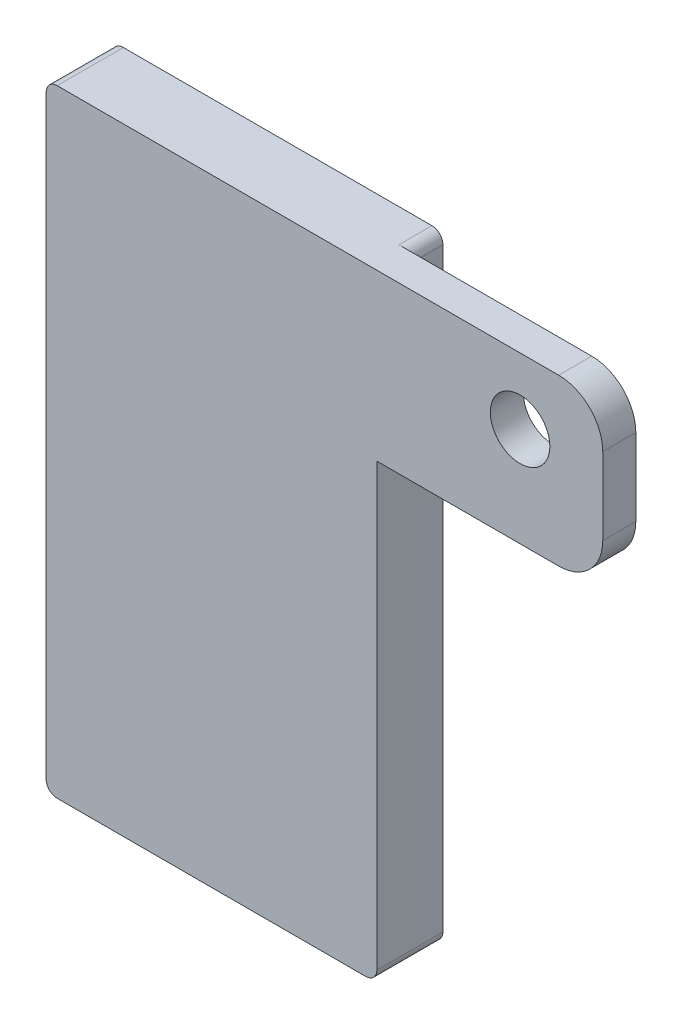
from build123d import *

# Parameters (mm, degrees)
SKETCH1_R           = 2.7
BOSS_EXTRUDE1_DEPTH = 3
SKETCH2_W           = 30
SKETCH2_H           = 56
SKETCH2_W_2         = 20
SKETCH2_H_2         = 46
BOSS_EXTRUDE2_DEPTH = 3
FILLET1_R           = 4
FILLET3_R           = 1


with BuildPart() as part:
    # Sketch1 → Boss-Extrude1 (new body)
    with BuildSketch(Plane.XY):
        Polygon((0, 0), (0, 56), (50.5, 56), (50.5, 41), (30, 41), (30, 0), align=None)
        with Locations((43, 50)):
            Circle(SKETCH1_R, mode=Mode.SUBTRACT)
    extrude(amount=BOSS_EXTRUDE1_DEPTH)

    # Sketch2 → Boss-Extrude2 (add)
    with BuildSketch(Plane(origin=(0, 0, 0), x_dir=(-1, 0, 0), z_dir=(0, 0, -1))):
        with Locations((-15, 28)):
            Rectangle(SKETCH2_W, SKETCH2_H)
        with Locations((-15, 28)):
            Rectangle(SKETCH2_W_2, SKETCH2_H_2, mode=Mode.SUBTRACT)
    extrude(amount=BOSS_EXTRUDE2_DEPTH)

    # Fillet1
    fillet1_edges = [part.edges().sort_by_distance(p)[0] for p in [
        (50.5, 56, 1.5),
        (50.5, 41, 1.5),
    ]]
    fillet(fillet1_edges, radius=FILLET1_R)

    # Fillet3
    fillet3_edges = [part.edges().sort_by_distance(p)[0] for p in [
        (0, 0, 0),
        (0, 56, 0),
        (30, 0, 0),
        (30, 56, -1.5),
    ]]
    fillet(fillet3_edges, radius=FILLET3_R)


solid = part.part
